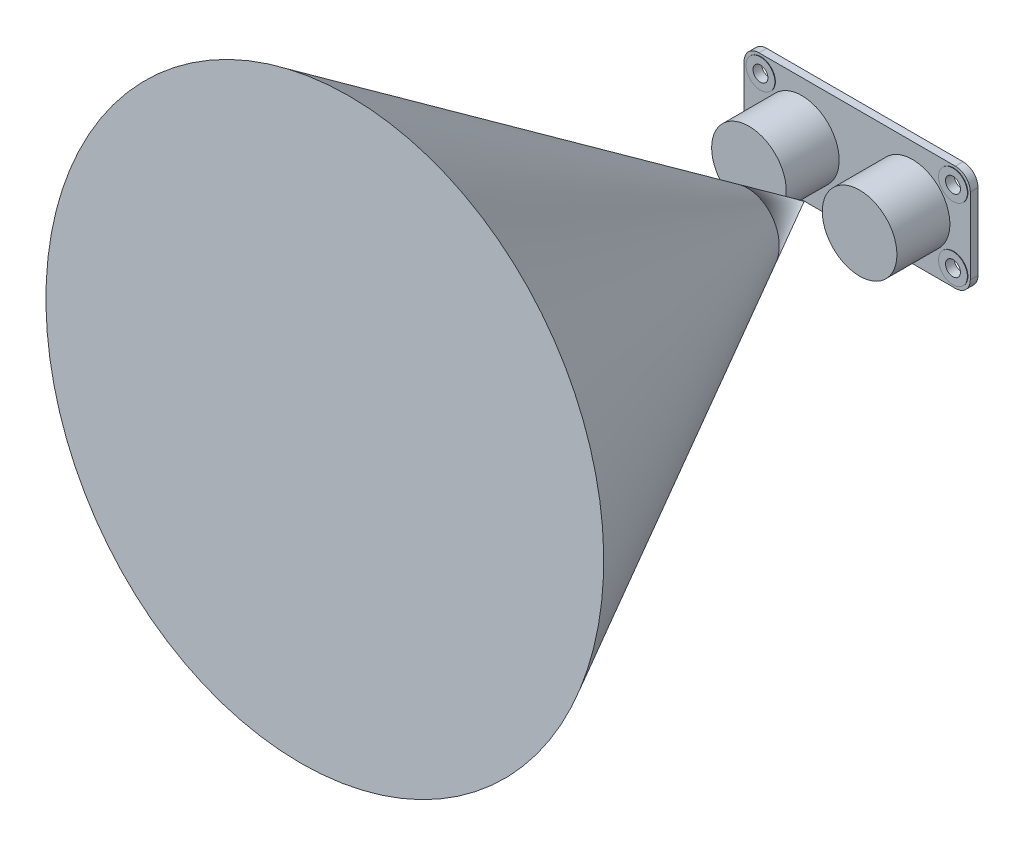
from build123d import *

# Parameters (mm, degrees)
SKETCH1_W                = 47
SKETCH1_H                = 22
SKETCH1_R                = 1.55
BOSS_EXTRUDE1_DEPTH      = 1.6
FILLET1_R                = 3.1
BOSS_EXTRUDE4_DEPTH      = 0.1
BOSS_EXTRUDE4_DEPTH_BACK = 1.7
SKETCH2_R                = 3
SKETCH2_R_2              = 1.55
SKETCH3_R                = 7.75
BOSS_EXTRUDE8_DEPTH      = 11


with BuildPart() as part:
    # Sketch1 → Boss-Extrude1 (new body)
    with BuildSketch(Plane.XY):
        Rectangle(SKETCH1_W, SKETCH1_H)
        with Locations((-20, 7.5)):
            Circle(SKETCH1_R, mode=Mode.SUBTRACT)
        with Locations((20, 7.5)):
            Circle(SKETCH1_R, mode=Mode.SUBTRACT)
        with Locations((20, -7.5)):
            Circle(SKETCH1_R, mode=Mode.SUBTRACT)
        with Locations((-20, -7.5)):
            Circle(SKETCH1_R, mode=Mode.SUBTRACT)
    extrude(amount=BOSS_EXTRUDE1_DEPTH)

    # Fillet1
    fillet1_edges = [part.edges().sort_by_distance(p)[0] for p in [
        (23.5, -11, 0.8),
        (-23.5, -11, 0.8),
        (-23.5, 11, 0.8),
        (23.5, 11, 0.8),
    ]]
    fillet(fillet1_edges, radius=FILLET1_R)

    # Sketch2 → Boss-Extrude4 (add, two sides: drawn at the far end of the back side and taken through both)
    # profile 1 of 4: a face of its own
    with BuildSketch(Plane.XY.offset(1.6).offset(-BOSS_EXTRUDE4_DEPTH_BACK)):
        with Locations((-20, 7.5)):
            Circle(SKETCH2_R)
        with Locations((-20, 7.5)):
            Circle(SKETCH2_R_2, mode=Mode.SUBTRACT)
    # profile 2 of 4: a face of its own
    with BuildSketch(Plane.XY.offset(1.6).offset(-BOSS_EXTRUDE4_DEPTH_BACK)):
        with Locations((-20, -7.5)):
            Circle(SKETCH2_R)
        with Locations((-20, -7.5)):
            Circle(SKETCH2_R_2, mode=Mode.SUBTRACT)
    # profile 3 of 4: a face of its own
    with BuildSketch(Plane.XY.offset(1.6).offset(-BOSS_EXTRUDE4_DEPTH_BACK)):
        with Locations((20, 7.5)):
            Circle(SKETCH2_R)
        with Locations((20, 7.5)):
            Circle(SKETCH2_R_2, mode=Mode.SUBTRACT)
    # profile 4 of 4: a face of its own
    with BuildSketch(Plane.XY.offset(1.6).offset(-BOSS_EXTRUDE4_DEPTH_BACK)):
        with Locations((20, -7.5)):
            Circle(SKETCH2_R)
        with Locations((20, -7.5)):
            Circle(SKETCH2_R_2, mode=Mode.SUBTRACT)
    extrude(amount=BOSS_EXTRUDE4_DEPTH + BOSS_EXTRUDE4_DEPTH_BACK)

    # Sketch3 → Boss-Extrude8 (add)
    with BuildSketch(Plane.XY.offset(1.6)):
        with Locations(Location((11.5, 0, 0), (0, 0, 180))):
            Circle(SKETCH3_R)
        with Locations(Location((-11.5, 0, 0), (0, 0, 180))):
            Circle(SKETCH3_R)
    extrude(amount=BOSS_EXTRUDE8_DEPTH)


with BuildPart() as body_2:
    # Sketch7 → Revolve1 (revolve)
    with BuildSketch(Plane(origin=(0, 0, 0), x_dir=(0, 0, -1), z_dir=(1, 0, 0)), mode=Mode.PRIVATE) as revolve1_sk:
        Polygon((-12.6, 0), (-107.187530655, 66.230901986), (-112.219469809, 8.715574275), align=None)
    revolve(revolve1_sk.sketch.rotate(Axis((0, 0, 12.6), (0, 0.08715574274765142, 0.9961946980917461)), 180), axis=Axis((0, 0, 12.6), (0, 0.08715574274765142, 0.9961946980917461)))


solid = Compound([part.part, body_2.part])
